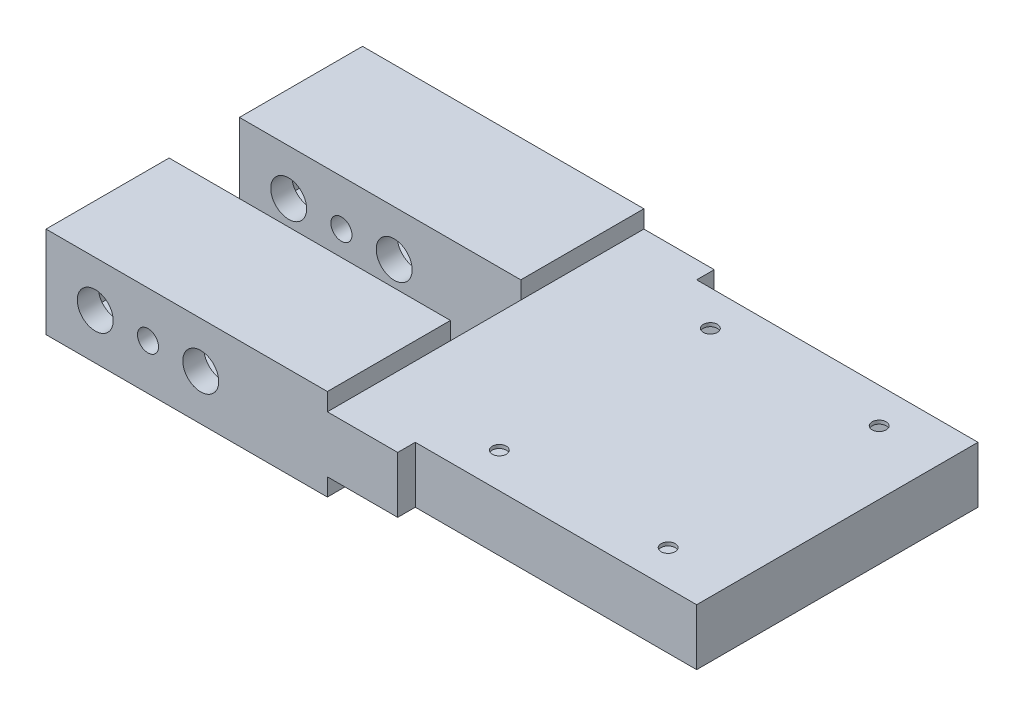
from build123d import *

# Parameters (mm, degrees)
BOSS_EXTRUDE1_DEPTH             = 5
BOSS_EXTRUDE1_DEPTH_BACK        = 5
SHELL1_T                        = -3
BOSS_EXTRUDE2_START             = 5
BOSS_EXTRUDE2_DEPTH             = 3
SKETCH2_R                       = 1.5
CUT_EXTRUDE1_DEPTH              = 100
F_1_4_20_TAPPED_HOLE1_D         = 5.1054
SKETCH9_W                       = 40
SKETCH9_H                       = 2.5
CUT_EXTRUDE2_DEPTH              = 79.072082078
SKETCH10_W                      = 10
SKETCH10_H                      = 45
CUT_EXTRUDE3_DEPTH              = 2.5
CUT_EXTRUDE4_START              = -10.5
SKETCH10_2_W                    = 10
SKETCH10_2_H                    = 45
CUT_EXTRUDE4_DEPTH              = 2.5
F_2_0MM_CLEARANCE_DOWEL_HOLE2_D = 2


with BuildPart() as part:
    # Sketch1 → Boss-Extrude1 (new, two sides: drawn at the far end of the back side and taken through both)
    with BuildSketch(Plane(origin=(0, 0, 0), x_dir=(1, 0, 0), z_dir=(0, 1, 0)).offset(-BOSS_EXTRUDE1_DEPTH_BACK)):
        Polygon((-25, -5), (-25, -22.5), (25, -22.5), (25, -20), (65, -20), (65, 20), (25, 20), (25, 22.5), (-25, 22.5), (-25, 5), (15, 5), (15, -5), align=None)
    extrude(amount=BOSS_EXTRUDE1_DEPTH + BOSS_EXTRUDE1_DEPTH_BACK)

    # Shell1
    shell1_openings = [part.faces().sort_by_distance(p)[0] for p in [
        (21.449275362, 5, 0),
    ]]
    offset(amount=SHELL1_T, openings=shell1_openings, kind=Kind.INTERSECTION)

    # Sketch1<2> → Boss-Extrude2 (add)
    with BuildSketch(Plane(origin=(0, 0, 0), x_dir=(1, 0, 0), z_dir=(0, 1, 0)).offset(BOSS_EXTRUDE2_START)):
        Polygon((-25, -5), (-25, -22.5), (25, -22.5), (25, -20), (65, -20), (65, 20), (25, 20), (25, 22.5), (-25, 22.5), (-25, 5), (15, 5), (15, -5), align=None)
    extrude(amount=BOSS_EXTRUDE2_DEPTH)

    # Sketch2 → Cut-Extrude1 (cut)
    with BuildSketch(Plane.XY.offset(22.5)):
        with Locations((-10.5, 1.5)):
            Circle(SKETCH2_R)
    extrude(amount=-CUT_EXTRUDE1_DEPTH, mode=Mode.SUBTRACT)

    # 1/4-20 Tapped Hole1 (through all)
    with Locations(Plane.XY.offset(22.5)):
        with Locations((-3, 1.5), (-18, 1.5)):
            Hole(F_1_4_20_TAPPED_HOLE1_D / 2)

    # Sketch9 → Cut-Extrude2 (cut, through all)
    with BuildSketch(Plane.XY.offset(20)):
        with Locations((45, 6.75)):
            Rectangle(SKETCH9_W, SKETCH9_H)
        with Locations((45, -3.75)):
            Rectangle(SKETCH9_W, SKETCH9_H)
    extrude(amount=-CUT_EXTRUDE2_DEPTH, mode=Mode.SUBTRACT)

    # Sketch10 → Cut-Extrude3 (cut)
    with BuildSketch(Plane(origin=(0, 8, 0), x_dir=(1, 0, 0), z_dir=(0, 1, 0))):
        with Locations((20, 0)):
            Rectangle(SKETCH10_W, SKETCH10_H)
    extrude(amount=-CUT_EXTRUDE3_DEPTH, mode=Mode.SUBTRACT)

    # Sketch10<2> → Cut-Extrude4 (cut)
    with BuildSketch(Plane(origin=(0, 8, 0), x_dir=(1, 0, 0), z_dir=(0, 1, 0)).offset(CUT_EXTRUDE4_START)):
        with Locations((20, 0)):
            Rectangle(SKETCH10_2_W, SKETCH10_2_H)
    extrude(amount=-CUT_EXTRUDE4_DEPTH, mode=Mode.SUBTRACT)

    # Ø2.0mm Clearance Dowel Hole2 (through all)
    with Locations(Plane(origin=(0, 5.5, 0), x_dir=(1, 0, 0), z_dir=(0, 1, 0))):
        with Locations((31.950000364, 15), (31.950000364, -15), (55.950000364, -15), (55.950000364, 15)):
            Hole(F_2_0MM_CLEARANCE_DOWEL_HOLE2_D / 2)


solid = part.part
